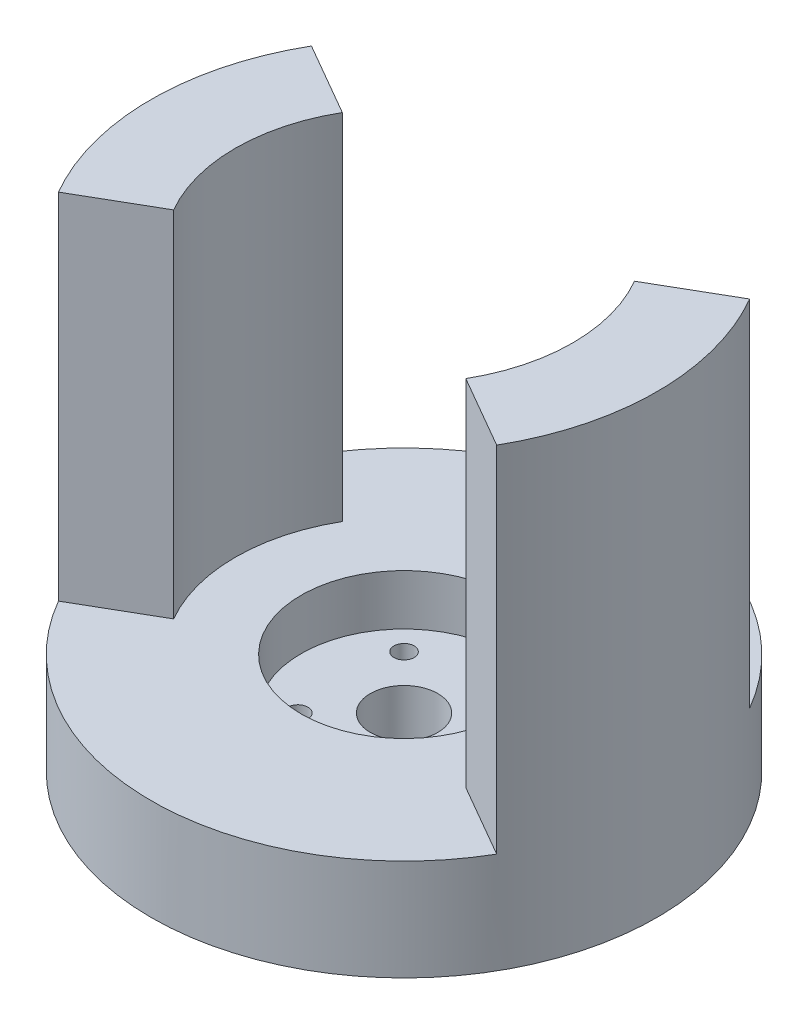
from build123d import *
from build123d.topology import SkipClean

# Parameters (mm, degrees)
SKETCH1_R           = 75
BOSS_EXTRUDE1_DEPTH = 30
SKETCH2_R           = 30.5
CUT_EXTRUDE1_DEPTH  = 15
BOSS_EXTRUDE2_DEPTH = 105
SKETCH4_R           = 10
CUT_EXTRUDE2_DEPTH  = 105
SKETCH5_R           = 3
CUT_EXTRUDE3_DEPTH  = 105


with BuildPart() as part:
    # Sketch1 → Boss-Extrude1 (new body)
    with BuildSketch(Plane(origin=(0, 0, 0), x_dir=(1, 0, 0), z_dir=(0, 1, 0))):
        with Locations(Location((0, 0, 0), (0, 0, 270))):
            Circle(SKETCH1_R)
    extrude(amount=BOSS_EXTRUDE1_DEPTH)

    # Sketch2 → Cut-Extrude1 (cut)
    with BuildSketch(Plane(origin=(0, 30, 0), x_dir=(1, 0, 0), z_dir=(0, 1, 0))):
        with Locations(Location((0, 0, 0), (0, 0, 270))):
            Circle(SKETCH2_R)
    extrude(amount=-CUT_EXTRUDE1_DEPTH, mode=Mode.SUBTRACT)

    # Sketch3 → Boss-Extrude2 (add)
    with SkipClean():  # the faces are left unmerged after this step: merging them gives an invalid solid
        with BuildSketch(Plane(origin=(0, 30, 0), x_dir=(1, 0, 0), z_dir=(0, 1, 0))):
            with BuildLine():
                Line((43.301270189, 25), (64.951905284, 37.5))
                ThreePointArc((64.951905284, 37.5), (75, 0), (64.951905284, -37.5))
                Line((64.951905284, -37.5), (43.301270189, -25))
                ThreePointArc((43.301270189, -25), (50, 0), (43.301270189, 25))
            make_face()
            with BuildLine():
                Line((-43.301270189, -25), (-64.951905284, -37.5))
                ThreePointArc((-64.951905284, -37.5), (-75, 0), (-64.951905284, 37.5))
                Line((-64.951905284, 37.5), (-43.301270189, 25))
                ThreePointArc((-43.301270189, 25), (-50, 0), (-43.301270189, -25))
            make_face()
        extrude(amount=BOSS_EXTRUDE2_DEPTH)

    # Sketch4 → Cut-Extrude2 (cut)
    with SkipClean():  # the faces are left unmerged after this step: merging them gives an invalid solid
        with BuildSketch(Plane.XZ):
            with Locations(Location((0, 0, 0), (0, 0, 270))):
                Circle(SKETCH4_R)
        extrude(amount=-CUT_EXTRUDE2_DEPTH, mode=Mode.SUBTRACT)

    # Sketch5 → Cut-Extrude3 (cut)
    with SkipClean():  # the faces are left unmerged after this step: merging them gives an invalid solid
        with BuildSketch(Plane.XZ):
            with Locations(Location((-15.733125881, 15.733125881, 0), (0, 0, 270))):
                Circle(SKETCH5_R)
            with Locations(Location((15.733125881, 15.733125881, 0), (0, 0, 270))):
                Circle(SKETCH5_R)
            with Locations(Location((15.733125881, -15.733125881, 0), (0, 0, 270))):
                Circle(SKETCH5_R)
            with Locations(Location((-15.733125881, -15.733125881, 0), (0, 0, 270))):
                Circle(SKETCH5_R)
        extrude(amount=-CUT_EXTRUDE3_DEPTH, mode=Mode.SUBTRACT)


solid = part.part
